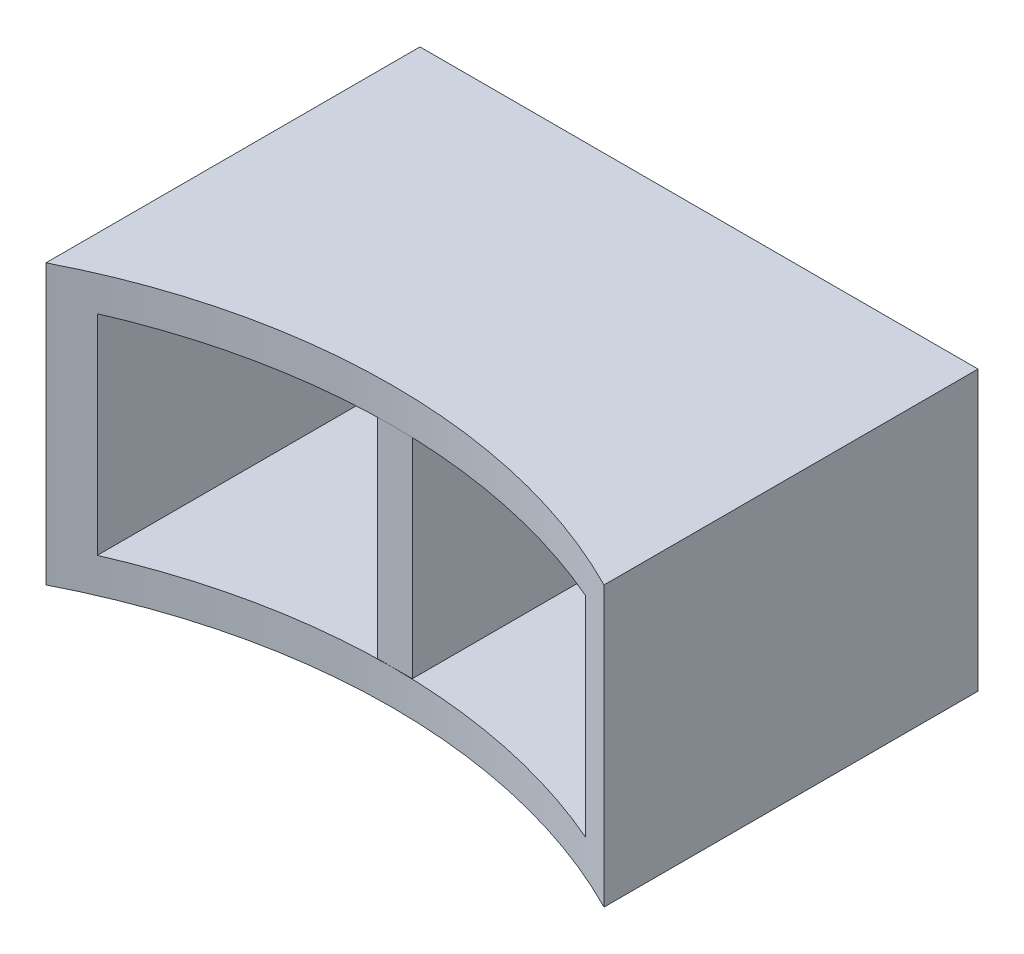
from build123d import *

# Parameters (mm, degrees)
BOSS_EXTRUDE2_DEPTH = 25.4
CUT_EXTRUDE1_START  = -3.175
SKETCH3_W           = 44.45
SKETCH3_H           = 19.05
CUT_EXTRUDE1_DEPTH  = 50.624586707
SKETCH4_W           = 3.175
SKETCH4_H           = 25.4
BOSS_EXTRUDE3_DEPTH = 27.94


with BuildPart() as part:
    # Sketch1 → Boss-Extrude2 (new body)
    with BuildSketch(Plane(origin=(0, 0, 0), x_dir=(1, 0, 0), z_dir=(0, 1, 0))):
        with BuildLine():
            Line((31.360925226, 34.045979578), (-19.439074774, 34.045979578))
            Line((-19.439074774, 34.045979578), (-19.439074774, 0))
            Line((-19.439074774, 0), (-19.437550774, 0))
            ThreePointArc((-19.437550774, 0), (5.961687226, 6.105979578), (31.360925226, 0))
            Line((31.360925226, 0), (31.360925226, 34.045979578))
        make_face()
    extrude(amount=BOSS_EXTRUDE2_DEPTH)

    # Sketch3 → Cut-Extrude1 (cut, through all)
    with BuildSketch(Plane(origin=(0, 0, -34.045979578), x_dir=(-1, 0, 0), z_dir=(0, 0, -1)).offset(CUT_EXTRUDE1_START)):
        with Locations((-5.962449226, 12.7)):
            Rectangle(SKETCH3_W, SKETCH3_H)
    extrude(amount=-CUT_EXTRUDE1_DEPTH, mode=Mode.SUBTRACT)

    # Sketch4 → Boss-Extrude3 (add)
    with BuildSketch(Plane(origin=(0, 0, -34.045979578), x_dir=(-1, 0, 0), z_dir=(0, 0, -1))):
        with Locations((-6.214925226, 12.7)):
            Rectangle(SKETCH4_W, SKETCH4_H)
    extrude(amount=-BOSS_EXTRUDE3_DEPTH)


solid = part.part
